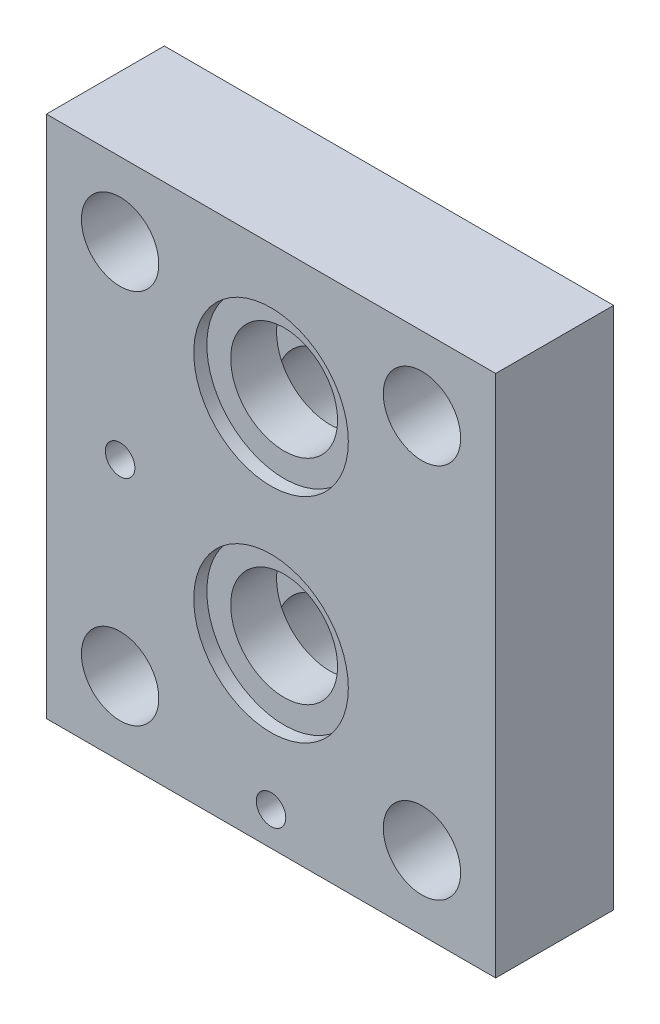
from build123d import *

# Parameters (mm, degrees)
SKETCH1_W                   = 112.776
SKETCH1_H                   = 96.774
BOSS_EXTRUDE1_DEPTH         = 12.7
F_5_8_CLEARANCE_HOLE1_D     = 16.66875
F_5_8_CLEARANCE_HOLE1_DEPTH = 25.4
F_5_8_CLEARANCE_HOLE1_TIP   = 5.007797722
F_5_8_CLEARANCE_HOLE2_D     = 16.66875
F_5_8_CLEARANCE_HOLE2_DEPTH = 25.4
F_5_8_CLEARANCE_HOLE2_TIP   = 5.007797722
CUT_EXTRUDE2_START          = -12.7
SKETCH6_R                   = 11.509375
CUT_EXTRUDE2_DEPTH          = 12.7
CUT_EXTRUDE4_START          = -12.7
SKETCH7_R                   = 11.509375
CUT_EXTRUDE4_DEPTH          = 12.7
CUT_EXTRUDE6_START          = 12.7
SKETCH8_R                   = 11.509375
CUT_EXTRUDE6_DEPTH          = 12.7
CUT_EXTRUDE8_START          = 12.7
SKETCH9_R                   = 11.509375
CUT_EXTRUDE8_DEPTH          = 12.7
CUT_EXTRUDE10_START         = 12.7
SKETCH10_R                  = 16.6497
CUT_EXTRUDE10_DEPTH         = 2.8194
CUT_EXTRUDE12_START         = 12.7
SKETCH11_R                  = 16.6497
CUT_EXTRUDE12_DEPTH         = 2.8194
CUT_EXTRUDE14_START         = -12.7
SKETCH14_R                  = 3.571875
CUT_EXTRUDE14_DEPTH         = 7.874
CUT_EXTRUDE16_START         = 12.7
SKETCH15_R                  = 3.175
CUT_EXTRUDE16_DEPTH         = 7.874


with BuildPart() as part:
    # Sketch1 → Boss-Extrude1 (new, symmetric)
    with BuildSketch(Plane(origin=(0, 0, 0), x_dir=(0, 1, 0), z_dir=(0, 0, 1))):
        Rectangle(SKETCH1_W, SKETCH1_H)
    extrude(amount=BOSS_EXTRUDE1_DEPTH, both=True)

    # 5/8 Clearance Hole1
    with Locations(Plane(origin=(0, 0, -12.7), x_dir=(-1, 0, 0), z_dir=(0, 0, -1))):
        with Locations((-32.512, -40.513)):
            Hole(F_5_8_CLEARANCE_HOLE1_D / 2, depth=F_5_8_CLEARANCE_HOLE1_DEPTH)
            with Locations((0, 0, -(F_5_8_CLEARANCE_HOLE1_DEPTH + F_5_8_CLEARANCE_HOLE1_TIP / 2))):  # 118° drill point
                Cone(0, F_5_8_CLEARANCE_HOLE1_D / 2, F_5_8_CLEARANCE_HOLE1_TIP, mode=Mode.SUBTRACT)

    # 5/8 Clearance Hole2
    with Locations(Plane(origin=(0, 0, -12.7), x_dir=(-1, 0, 0), z_dir=(0, 0, -1))):
        with Locations((-32.512, 40.513), (32.512, -40.513), (32.512, 40.513)):
            Hole(F_5_8_CLEARANCE_HOLE2_D / 2, depth=F_5_8_CLEARANCE_HOLE2_DEPTH)
            with Locations((0, 0, -(F_5_8_CLEARANCE_HOLE2_DEPTH + F_5_8_CLEARANCE_HOLE2_TIP / 2))):  # 118° drill point
                Cone(0, F_5_8_CLEARANCE_HOLE2_D / 2, F_5_8_CLEARANCE_HOLE2_TIP, mode=Mode.SUBTRACT)

    # Sketch6 → Cut-Extrude2 (cut)
    with BuildSketch(Plane(origin=(0, 0, 0), x_dir=(0, 1, 0), z_dir=(0, 0, 1)).offset(CUT_EXTRUDE2_START)):
        with Locations(Location((-27.813, 0, 0), (0, 0, 270))):
            Circle(SKETCH6_R)
    extrude(amount=CUT_EXTRUDE2_DEPTH, mode=Mode.SUBTRACT)

    # Sketch7 → Cut-Extrude4 (cut)
    with BuildSketch(Plane(origin=(0, 0, 0), x_dir=(0, 1, 0), z_dir=(0, 0, 1)).offset(CUT_EXTRUDE4_START)):
        with Locations(Location((18.161, 0, 0), (0, 0, 270))):
            Circle(SKETCH7_R)
    extrude(amount=CUT_EXTRUDE4_DEPTH, mode=Mode.SUBTRACT)

    # Sketch8 → Cut-Extrude6 (cut)
    with BuildSketch(Plane(origin=(0, 0, 0), x_dir=(0, 1, 0), z_dir=(0, 0, 1)).offset(CUT_EXTRUDE6_START)):
        with Locations(Location((-18.161, 0, 0), (0, 0, 270))):
            Circle(SKETCH8_R)
    extrude(amount=-CUT_EXTRUDE6_DEPTH, mode=Mode.SUBTRACT)

    # Sketch9 → Cut-Extrude8 (cut)
    with BuildSketch(Plane(origin=(0, 0, 0), x_dir=(0, 1, 0), z_dir=(0, 0, 1)).offset(CUT_EXTRUDE8_START)):
        with Locations(Location((27.813, 0, 0), (0, 0, 270))):
            Circle(SKETCH9_R)
    extrude(amount=-CUT_EXTRUDE8_DEPTH, mode=Mode.SUBTRACT)

    # Sketch10 → Cut-Extrude10 (cut)
    with BuildSketch(Plane(origin=(0, 0, 0), x_dir=(0, 1, 0), z_dir=(0, 0, 1)).offset(CUT_EXTRUDE10_START)):
        with Locations(Location((-18.161, 0, 0), (0, 0, 270))):
            Circle(SKETCH10_R)
    extrude(amount=-CUT_EXTRUDE10_DEPTH, mode=Mode.SUBTRACT)

    # Sketch11 → Cut-Extrude12 (cut)
    with BuildSketch(Plane(origin=(0, 0, 0), x_dir=(0, 1, 0), z_dir=(0, 0, 1)).offset(CUT_EXTRUDE12_START)):
        with Locations(Location((27.813, 0, 0), (0, 0, 270))):
            Circle(SKETCH11_R)
    extrude(amount=-CUT_EXTRUDE12_DEPTH, mode=Mode.SUBTRACT)

    # Sketch14 → Cut-Extrude14 (cut)
    with BuildSketch(Plane(origin=(0, 0, 0), x_dir=(0, 1, 0), z_dir=(0, 0, 1)).offset(CUT_EXTRUDE14_START)):
        with Locations(Location((49.149, 0, 0), (0, 0, 270))):
            Circle(SKETCH14_R)
        with Locations(Location((0.127, -32.512, 0), (0, 0, 270))):
            Circle(SKETCH14_R)
    extrude(amount=CUT_EXTRUDE14_DEPTH, mode=Mode.SUBTRACT)

    # Sketch15 → Cut-Extrude16 (cut)
    with BuildSketch(Plane(origin=(0, 0, 0), x_dir=(0, 1, 0), z_dir=(0, 0, 1)).offset(CUT_EXTRUDE16_START)):
        with Locations(Location((-49.149, 0, 0), (0, 0, 270))):
            Circle(SKETCH15_R)
        with Locations(Location((-0.127, 32.512, 0), (0, 0, 270))):
            Circle(SKETCH15_R)
    extrude(amount=-CUT_EXTRUDE16_DEPTH, mode=Mode.SUBTRACT)


solid = part.part
